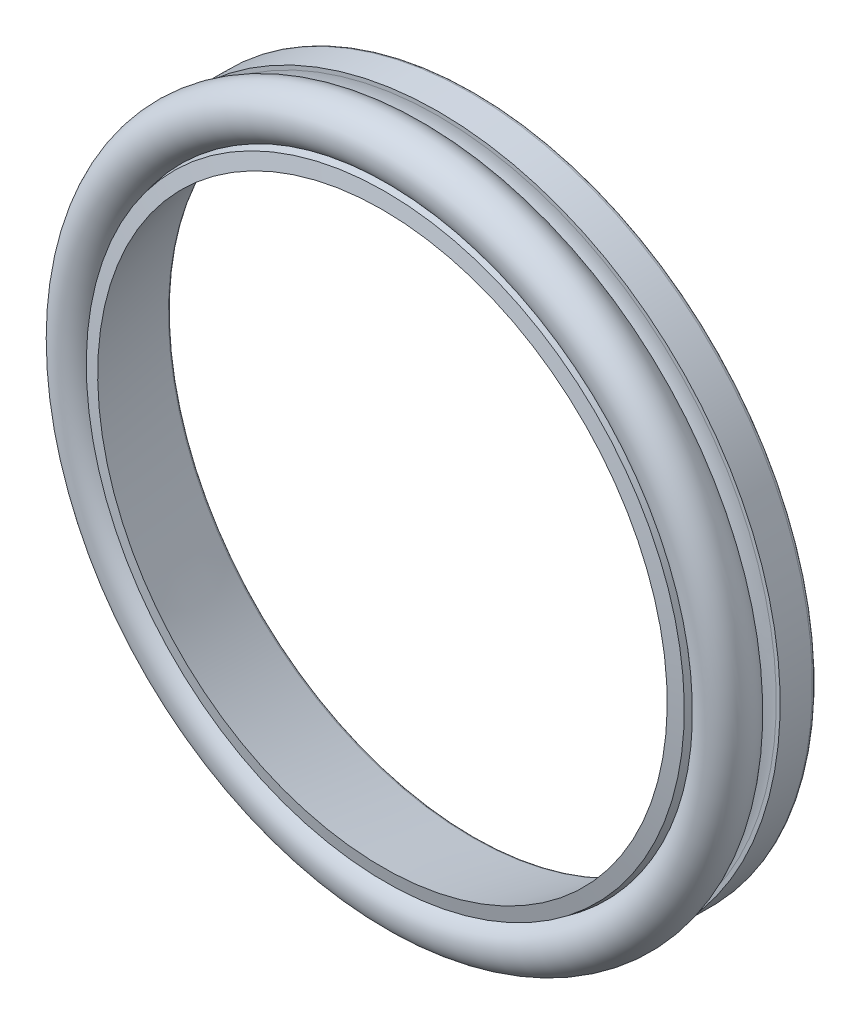
from build123d import *

# Parameters (mm, degrees)
FILLET1_R = 0.2
SKETCH2_R = 1.31


with BuildPart() as part:
    # Sketch1 → Revolve1 (revolve)
    with BuildSketch(Plane(origin=(0, 0, 0), x_dir=(0, 0, -1), z_dir=(1, 0, 0))):
        with BuildLine():
            Line((-1.9, 18), (0, 18))
            Line((0, 18), (0, 16))
            Line((0, 16), (-4.85, 15))
            Line((-4.85, 15), (-4.7, 15.75))
            Line((-4.7, 15.75), (-3.336511953, 16.031131556))
            ThreePointArc((-3.336511953, 16.031131556), (-2.304600687, 16.657008232), (-1.9, 17.794048582))
            Line((-1.9, 17.794048582), (-1.9, 18))
        make_face()
    revolve(axis=Axis((0, 0, 0), (0, 0, 1)))

    # Fillet1
    fillet1_edges = [part.edges().sort_by_distance(p)[0] for p in [
        (0, -16, 0),
        (0, -18, 0),
    ]]
    fillet(fillet1_edges, radius=FILLET1_R)


with BuildPart() as body_2:
    # Sketch2 → Revolve2 (revolve)
    with BuildSketch(Plane(origin=(0, 0, 0), x_dir=(0, 0, -1), z_dir=(1, 0, 0)), mode=Mode.PRIVATE) as revolve2_sk:
        with Locations((-3.69, 17.02)):
            Circle(SKETCH2_R)
    revolve(revolve2_sk.sketch.rotate(Axis((0, 0, 0), (0, 0, 1)), 90), axis=Axis((0, 0, 0), (0, 0, 1)))


solid = Compound([part.part, body_2.part])
